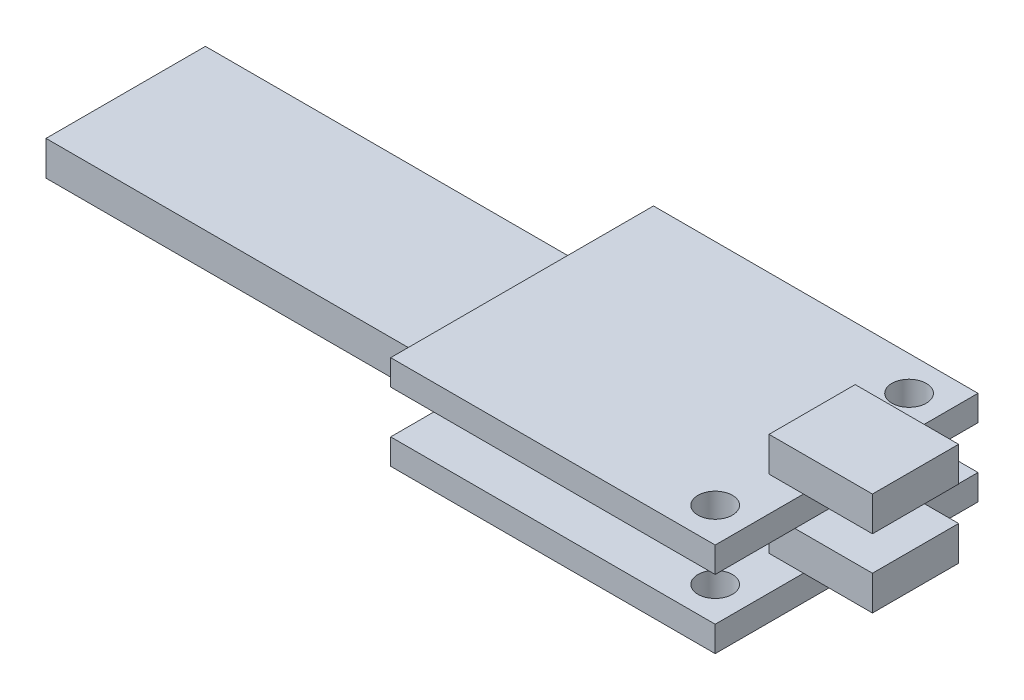
from build123d import *

# Parameters (mm, degrees)
SKETCH1_W           = 18.83
SKETCH1_H           = 15.25
SKETCH1_R           = 1
BOSS_EXTRUDE1_DEPTH = 1.48
SKETCH2_W           = 6
SKETCH2_H           = 5
BOSS_EXTRUDE2_DEPTH = 2
SKETCH3_R           = 0.901743866
BOSS_EXTRUDE3_DEPTH = 2.5
SKETCH4_W           = 2
SKETCH4_H           = 5
SKETCH4_R           = 1
BOSS_EXTRUDE4_DEPTH = 1.48
SKETCH5_W           = 6
SKETCH5_H           = 5
BOSS_EXTRUDE5_DEPTH = 2
SKETCH6_W           = 2
SKETCH6_H           = 9.25
BOSS_EXTRUDE6_DEPTH = 2
SKETCH7_W           = 9.25
SKETCH7_H           = 2
BOSS_EXTRUDE7_DEPTH = 23
SKETCH9_R           = 1.5
BOSS_EXTRUDE8_DEPTH = 2


with BuildPart() as part:
    # Sketch1 → Boss-Extrude1 (new body)
    with BuildSketch(Plane(origin=(0, 0, 0), x_dir=(1, 0, 0), z_dir=(0, 1, 0))):
        with Locations((9.415, 7.625)):
            Rectangle(SKETCH1_W, SKETCH1_H)
        with Locations(Location((16.83, 13.25, 0), (0, 0, 270))):
            Circle(SKETCH1_R, mode=Mode.SUBTRACT)
        with Locations(Location((16.83, 2, 0), (0, 0, 270))):
            Circle(SKETCH1_R, mode=Mode.SUBTRACT)
    extrude(amount=BOSS_EXTRUDE1_DEPTH)

    # Sketch2 → Boss-Extrude2 (add)
    with BuildSketch(Plane(origin=(0, 1.48, 0), x_dir=(1, 0, 0), z_dir=(0, 1, 0))):
        with Locations((19.83, 7.625)):
            Rectangle(SKETCH2_W, SKETCH2_H)
    extrude(amount=BOSS_EXTRUDE2_DEPTH)

    # Sketch3 → Boss-Extrude3 (add)
    with BuildSketch(Plane(origin=(0, 1.48, 0), x_dir=(1, 0, 0), z_dir=(0, 1, 0))):
        with Locations(Location((9.415, 7.625, 0), (0, 0, 90))):
            Circle(SKETCH3_R)
    extrude(amount=BOSS_EXTRUDE3_DEPTH)

    # Sketch6 → Boss-Extrude6 (add)
    with BuildSketch(Plane(origin=(0, 1.48, 0), x_dir=(1, 0, 0), z_dir=(0, 1, 0))):
        with Locations((1, 7.625)):
            Rectangle(SKETCH6_W, SKETCH6_H)
    extrude(amount=BOSS_EXTRUDE6_DEPTH)

    # Sketch7 → Boss-Extrude7 (add)
    with BuildSketch(Plane.ZY):
        with Locations((-7.625, 2.48)):
            Rectangle(SKETCH7_W, SKETCH7_H)
    extrude(amount=BOSS_EXTRUDE7_DEPTH)

    # Sketch9 → Boss-Extrude8 (add)
    with BuildSketch(Plane.XZ):
        with Locations(Location((8.83, -7.625, 0), (0, 0, 270))):
            Circle(SKETCH9_R)
    extrude(amount=BOSS_EXTRUDE8_DEPTH)


with BuildPart() as body_2:
    # Sketch4 → Boss-Extrude4 (new body)
    # profile 1 of 2: a face of its own
    with BuildSketch(Plane(origin=(0, 3.98, 0), x_dir=(1, 0, 0), z_dir=(0, 1, 0))):
        with Locations((17.83, 7.625)):
            Rectangle(SKETCH4_W, SKETCH4_H)
    # profile 2 of 2: a face of its own
    with BuildSketch(Plane(origin=(0, 3.98, 0), x_dir=(1, 0, 0), z_dir=(0, 1, 0))):
        Polygon((18.83, 0), (18.83, 5.125), (16.83, 5.125), (16.83, 10.125), (18.83, 10.125), (18.83, 15.25), (0, 15.25), (0, 0), align=None)
        with Locations(Location((16.83, 2, 0), (0, 0, 270))):
            Circle(SKETCH4_R, mode=Mode.SUBTRACT)
        with Locations(Location((16.83, 13.25, 0), (0, 0, 270))):
            Circle(SKETCH4_R, mode=Mode.SUBTRACT)
    extrude(amount=BOSS_EXTRUDE4_DEPTH)

    # Sketch5 → Boss-Extrude5 (add)
    with BuildSketch(Plane(origin=(0, 5.46, 0), x_dir=(1, 0, 0), z_dir=(0, 1, 0))):
        with Locations((19.83, 7.625)):
            Rectangle(SKETCH5_W, SKETCH5_H)
    extrude(amount=BOSS_EXTRUDE5_DEPTH)


solid = Compound([part.part, body_2.part])
